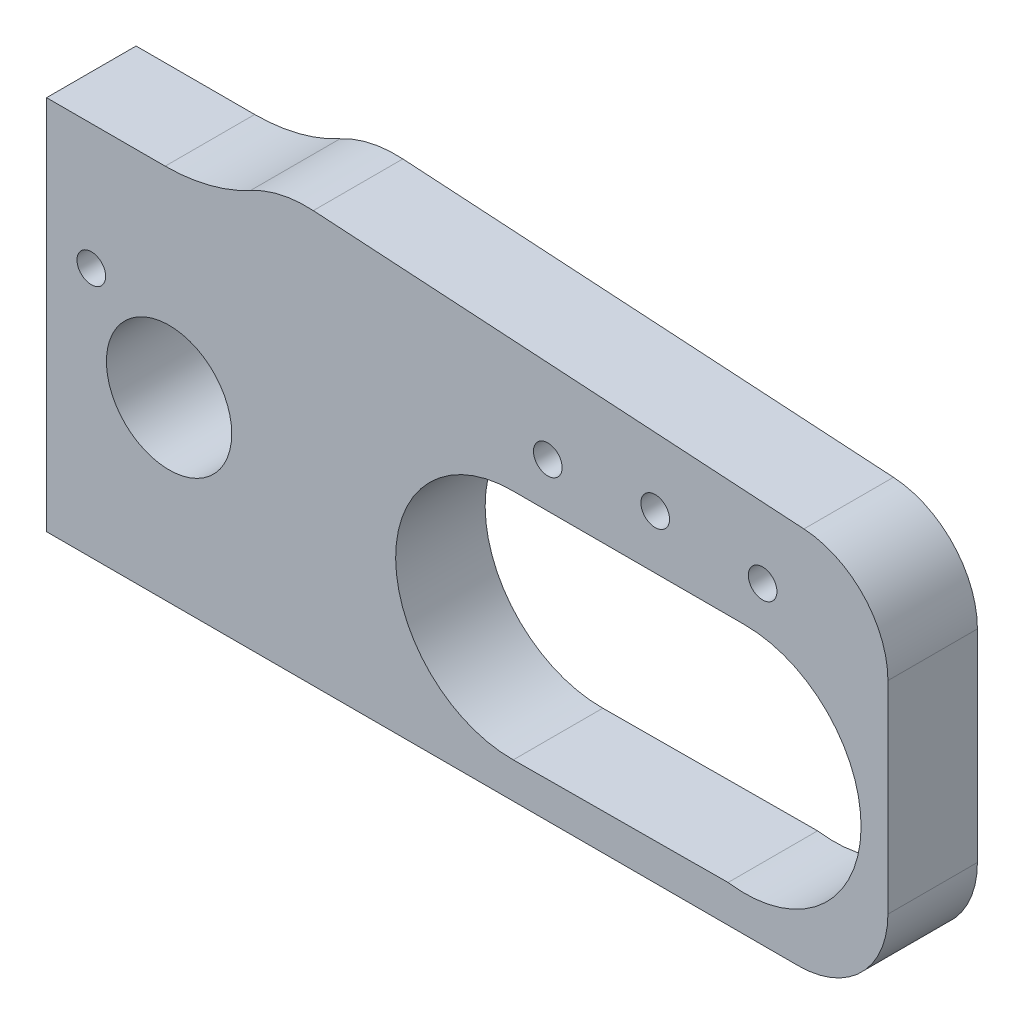
from build123d import *

# Parameters (mm, degrees)
SKETCH1_R           = 0.8
SKETCH1_R_2         = 3.5
SKETCH1_R_3         = 5.1
BOSS_EXTRUDE1_DEPTH = 5
SKETCH2_R           = 1.25
CUT_EXTRUDE1_DEPTH  = 4
BOSS_EXTRUDE2_START = -1
SKETCH21_R          = 5.1
BOSS_EXTRUDE2_DEPTH = 1


with BuildPart() as part:
    # Sketch1 → Boss-Extrude1 (new body)
    with BuildSketch(Plane(origin=(0, 0, 0), x_dir=(0, 1, 0), z_dir=(0, 0, 1))):
        with BuildLine():
            ThreePointArc((7.923715338, -23.061842121), (11.348253353, -21.704991773), (12.914157128, -18.370857874))
            Line((12.914157128, -18.370857874), (14.611258571, 9.036437401))
            ThreePointArc((14.611258571, 9.036437401), (14.470096631, 10.842810788), (13.835805455, 12.540039768))
            ThreePointArc((13.835805455, 12.540039768), (12.931450551, 14.850335933), (12.623684243, 17.312165753))
            Line((12.623684243, 17.312165753), (12.623684243, 23.938157879))
            Line((12.623684243, 23.938157879), (-8.376315757, 23.938157879))
            Line((-8.376315757, 23.938157879), (-8.376315757, -18.061842121))
            ThreePointArc((-8.376315757, -18.061842121), (-6.911849663, -21.597376027), (-3.376315757, -23.061842121))
            Line((-3.376315757, -23.061842121), (7.923715338, -23.061842121))
        make_face()
        with BuildLine():
            Line((-6.37591859, -2.133696229), (-6.376315757, -2.061842121))
            ThreePointArc((-6.376315757, -2.061842121), (0.123684243, 4.438157879), (6.623684243, -2.061842121))
            Line((6.623684243, -2.061842121), (6.623684243, -15.061842121))
            ThreePointArc((6.623684243, -15.061842121), (0.625179068, -21.542467318), (-6.298932046, -16.061842121))
            ThreePointArc((-6.298932046, -16.061842121), (-6.376216465, -15.097769724), (-6.309594086, -14.132901895))
            Line((-6.309594086, -14.132901895), (-6.37591859, -2.133696229))
        make_face(mode=Mode.SUBTRACT)
        with Locations(Location((9.123684243, -16.061842121, 0), (0, 0, 270))):
            Circle(SKETCH1_R, mode=Mode.SUBTRACT)
        with Locations(Location((9.623684243, -10.061842121, 0), (0, 0, 270))):
            Circle(SKETCH1_R, mode=Mode.SUBTRACT)
        with Locations(Location((9.123684243, -4.061842121, 0), (0, 0, 270))):
            Circle(SKETCH1_R, mode=Mode.SUBTRACT)
        with Locations(Location((1.537022692, 17.094912388, 0), (0, 0, 270))):
            Circle(SKETCH1_R_2, mode=Mode.SUBTRACT)
        with Locations(Location((8.123684243, 9.438157879, 0), (0, 0, 270))):
            Circle(SKETCH1_R_3, mode=Mode.SUBTRACT)
        with Locations(Location((5.623684243, 21.438157879, 0), (0, 0, 270))):
            Circle(SKETCH1_R, mode=Mode.SUBTRACT)
    extrude(amount=BOSS_EXTRUDE1_DEPTH)

    # Sketch2 → Cut-Extrude1 (cut)
    with BuildSketch(Plane(origin=(-23.938157879, 0, 0), x_dir=(0, -1, 0), z_dir=(-1, 0, 0))):
        with Locations(Location((-9.623684243, 2.5, 0), (0, 0, 90))):
            Circle(SKETCH2_R)
        with Locations(Location((2.876315757, 2.5, 0), (0, 0, 90))):
            Circle(SKETCH2_R)
    extrude(amount=-CUT_EXTRUDE1_DEPTH, mode=Mode.SUBTRACT)

    # Sketch21 → Boss-Extrude2 (add)
    with BuildSketch(Plane.XY.offset(5).offset(BOSS_EXTRUDE2_START)):
        with Locations((-9.438157879, 8.123684243)):
            Circle(SKETCH21_R)
    extrude(amount=BOSS_EXTRUDE2_DEPTH)


solid = part.part
